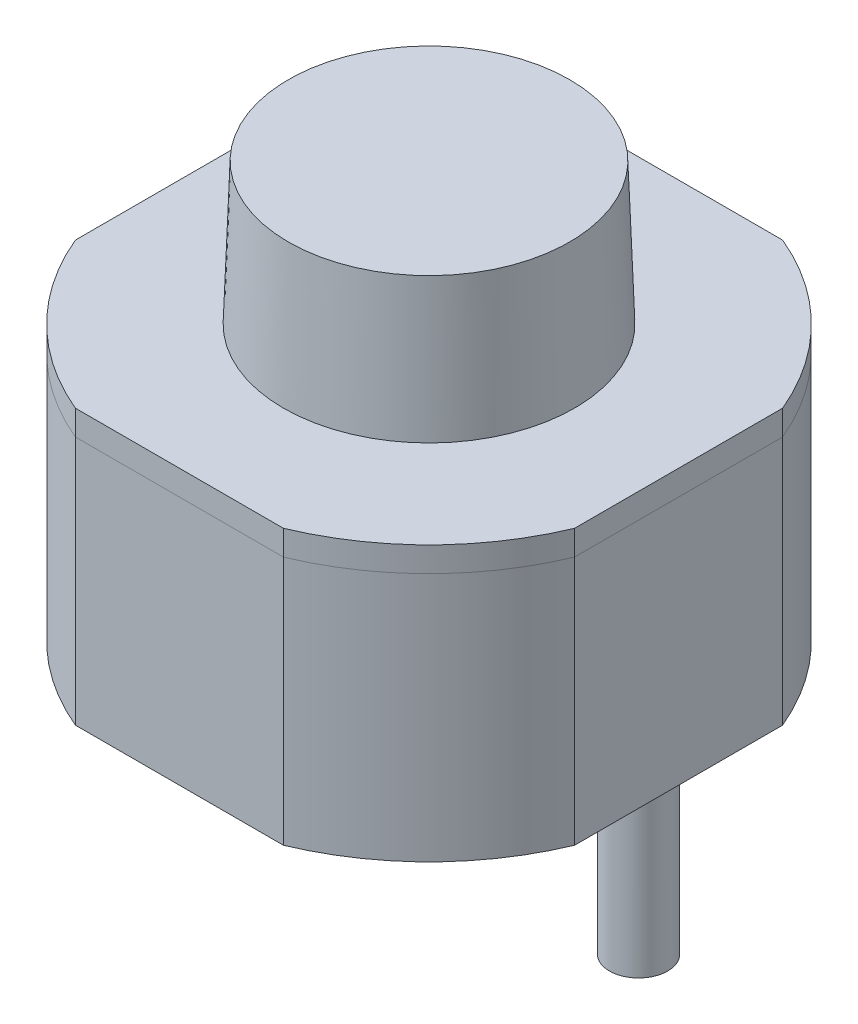
from build123d import *

# Parameters (mm, degrees)
SCHIZZO1_W                   = 6
SCHIZZO1_H                   = 6
ESTRUSIONE_ESTRUSIONE1_DEPTH = 3
SCHIZZO2_OUTSIDE_W           = 9.8
SCHIZZO2_OUTSIDE_H           = 9.8
SCHIZZO2_OUTSIDE_R           = 3.25
TAGLIO_ESTRUSIONE1_DEPTH     = 6.196152423
SCHIZZO3_R                   = 0.35
ESTRUSIONE_ESTRUSIONE2_DEPTH = 2
ESTRUSIONE_ESTRUSIONE3_DEPTH = 0.3
SCHIZZO5_R                   = 1.75
ESTRUSIONE_ESTRUSIONE4_DEPTH = 1.7
ESTRUSIONE_ESTRUSIONE4_TAPER = 2


with BuildPart() as part:
    # Schizzo1 → Estrusione-Estrusione1 (new body)
    with BuildSketch(Plane(origin=(0, 0, 0), x_dir=(1, 0, 0), z_dir=(0, 1, 0))):
        Rectangle(SCHIZZO1_W, SCHIZZO1_H)
    extrude(amount=ESTRUSIONE_ESTRUSIONE1_DEPTH)

    # Schizzo2 outside → Taglio-Estrusione1 (cut, through all)
    with BuildSketch(Plane(origin=(0, 3, 0), x_dir=(1, 0, 0), z_dir=(0, 1, 0))):
        Rectangle(SCHIZZO2_OUTSIDE_W, SCHIZZO2_OUTSIDE_H)
        Circle(SCHIZZO2_OUTSIDE_R, mode=Mode.SUBTRACT)
    extrude(amount=-TAGLIO_ESTRUSIONE1_DEPTH, mode=Mode.SUBTRACT)

    # Schizzo3 → Estrusione-Estrusione2 (add)
    with BuildSketch(Plane.XZ):
        with Locations(Location((-2.518939755, 0, 0), (0, 0, 90))):
            Circle(SCHIZZO3_R)
        with Locations(Location((2.518939755, 0, 0), (0, 0, 90))):
            Circle(SCHIZZO3_R)
    extrude(amount=ESTRUSIONE_ESTRUSIONE2_DEPTH)


with BuildPart() as body_2:
    # Schizzo4 → Estrusione-Estrusione3 (new body)
    with BuildSketch(Plane(origin=(0, 3, 0), x_dir=(1, 0, 0), z_dir=(0, 1, 0))):
        with BuildLine():
            Line((-1.25, -3), (1.25, -3))
            ThreePointArc((1.25, -3), (2.298097039, -2.298097039), (3, -1.25))
            Line((3, -1.25), (3, 1.25))
            ThreePointArc((3, 1.25), (2.298097039, 2.298097039), (1.25, 3))
            Line((1.25, 3), (-1.25, 3))
            ThreePointArc((-1.25, 3), (-2.298097039, 2.298097039), (-3, 1.25))
            Line((-3, 1.25), (-3, -1.25))
            ThreePointArc((-3, -1.25), (-2.298097039, -2.298097039), (-1.25, -3))
        make_face()
    extrude(amount=ESTRUSIONE_ESTRUSIONE3_DEPTH)


with BuildPart() as body_3:
    # Schizzo5 → Estrusione-Estrusione4 (new body)
    with BuildSketch(Plane(origin=(0, 3.3, 0), x_dir=(1, 0, 0), z_dir=(0, 1, 0))):
        Circle(SCHIZZO5_R)
    extrude(amount=ESTRUSIONE_ESTRUSIONE4_DEPTH, taper=ESTRUSIONE_ESTRUSIONE4_TAPER)


solid = Compound([part.part, body_2.part, body_3.part])
